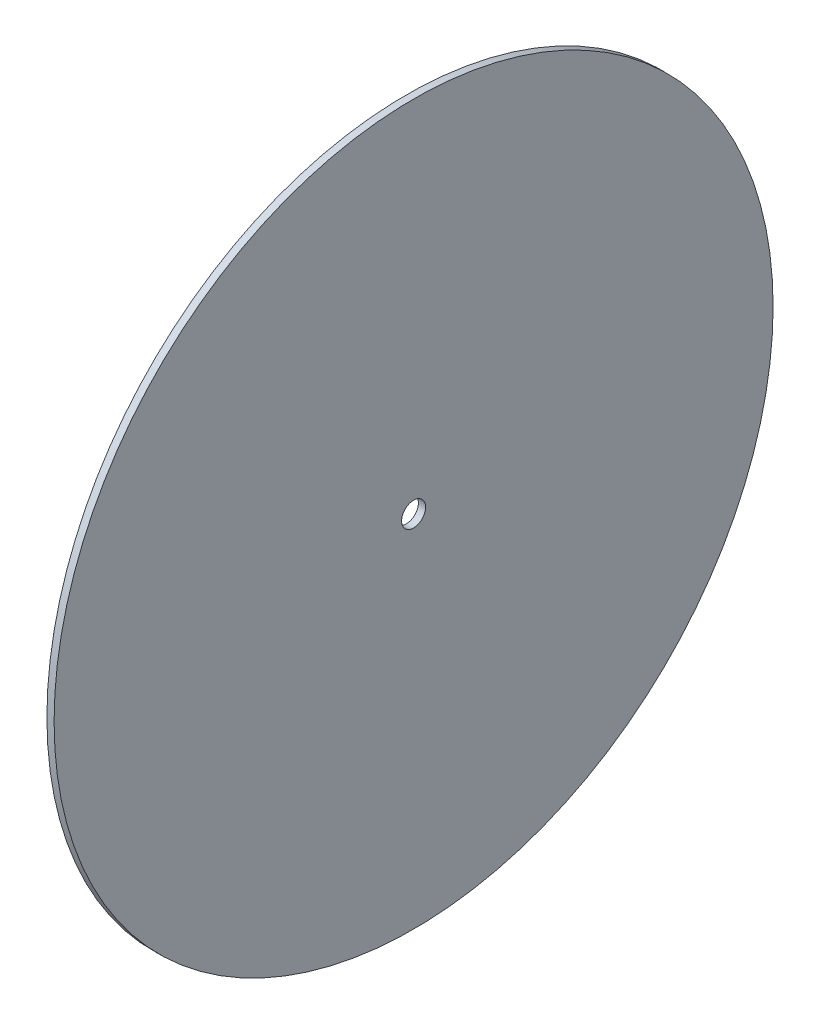
from build123d import *

# Parameters (mm, degrees)
SKETCH1_W = 3
SKETCH1_H = 145


with BuildPart() as part:
    # Sketch1 → Revolve1 (revolve)
    with BuildSketch(Plane(origin=(0, 0, 0), x_dir=(1, 0, 0), z_dir=(0, 1, 0))):
        with Locations((1.5, -77.5)):
            Rectangle(SKETCH1_W, SKETCH1_H)
    revolve(axis=Axis((0, 0, 0), (1, 0, 0)))


solid = part.part
